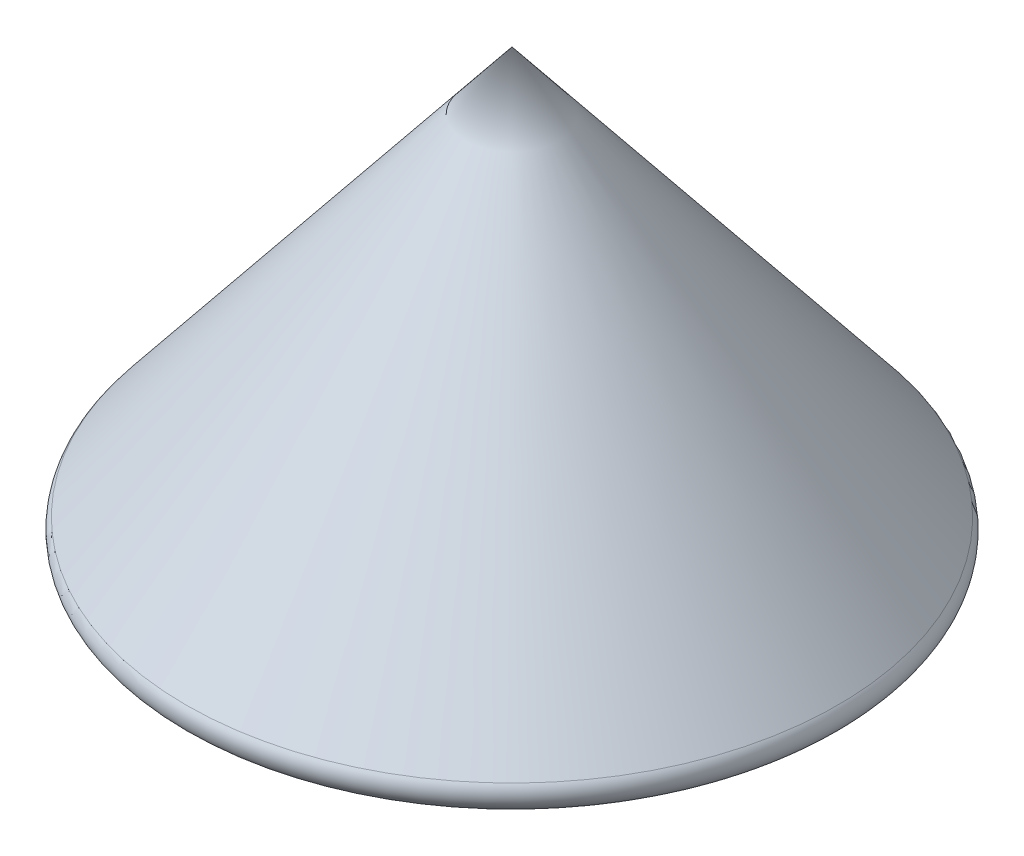
from build123d import *

# Parameters (mm, degrees)
SKETCH2_R          = 2.9
CUT_EXTRUDE1_DEPTH = 13
FILLET1_R          = 1


with BuildPart() as part:
    # Sketch1 → Revolve1 (revolve)
    with BuildSketch(Plane.XY, mode=Mode.PRIVATE) as revolve1_sk:
        Polygon((0, 0), (20, 0), (0, 25), align=None)
    revolve(revolve1_sk.sketch.rotate(Axis((0, 25, 0), (0, -1, 0)), 270), axis=Axis((0, 25, 0), (0, -1, 0)))

    # Sketch2 → Cut-Extrude1 (cut)
    with BuildSketch(Plane.XZ):
        with Locations(Location((0, 0, 0), (0, 0, 270))):
            Circle(SKETCH2_R)
    extrude(amount=-CUT_EXTRUDE1_DEPTH, mode=Mode.SUBTRACT)

    # Fillet1
    fillet1_edges = [part.edges().sort_by_distance(p)[0] for p in [
        (0, 0, 20),
    ]]
    fillet(fillet1_edges, radius=FILLET1_R)


solid = part.part
